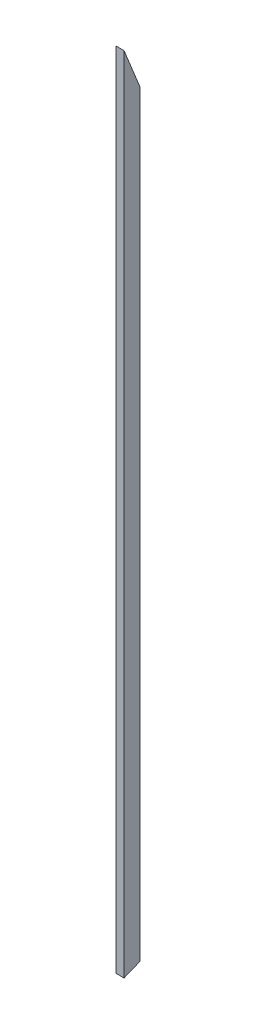
from build123d import *

# Parameters (mm, degrees)
SKETCH_1_W          = 25
SKETCH_1_H          = 50
EXTRUDE_1_DEPTH     = 2534.75837113
CUT_EXTRUDE_1_DEPTH = 2534.75837113


with BuildPart() as part:
    # Эскиз1 → Бобышка-Вытянуть1 (new body)
    with BuildSketch(Plane(origin=(0, 0, 0), x_dir=(1, 0, 0), z_dir=(0, 1, 0))):
        Rectangle(SKETCH_1_W, SKETCH_1_H)
    extrude(amount=EXTRUDE_1_DEPTH)

    # Эскиз2 → Вырез-Вытянуть1 (cut)
    with BuildSketch(Plane(origin=(12.5, 0, 0), x_dir=(0, 0, -1), z_dir=(1, 0, 0))):
        Polygon((25, 0), (25, 20.21276596), (-25, 0), align=None)
        Polygon((25, 2534.75837113), (25, 2411.0741606), (-25, 2534.75837113), align=None)
    extrude(amount=-CUT_EXTRUDE_1_DEPTH, mode=Mode.SUBTRACT)


solid = part.part
